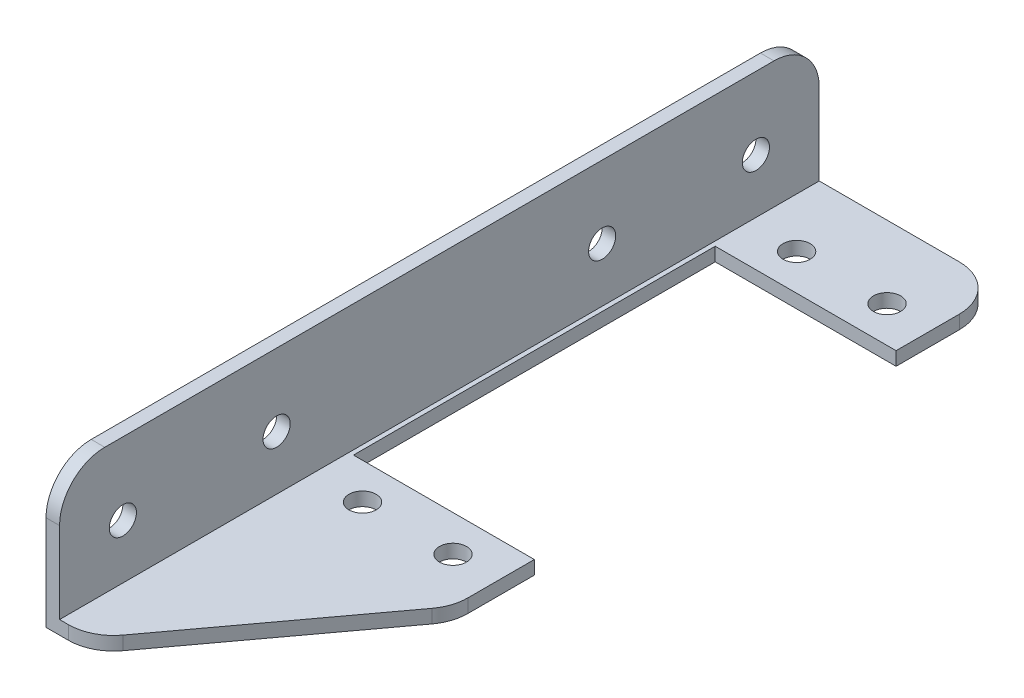
from build123d import *

# Parameters (mm, degrees)
EXTRU_MINCE1_DEPTH      = 84
ESQUISSE2_R             = 1.5
ENL_V_MAT_EXTRU_1_DEPTH = 8
ESQUISSE3_R             = 1.5
ESQUISSE3_W             = 25.5
ESQUISSE3_H             = 40
ENL_V_MAT_EXTRU_2_DEPTH = 5
ESQUISSE4_W             = 5.5
ESQUISSE4_H             = 84
ENL_V_MAT_EXTRU_3_DEPTH = 6
CHANFREIN1_SIZE         = 17
CHANFREIN1_SIZE2        = 23
CONG_1_R                = 5


with BuildPart() as part:
    # Esquisse1 → Extru.-Mince1 (new body)
    with BuildSketch(Plane.XY):
        Polygon((0, 15.5), (0, 0), (27.5, 0), (27.5, 1.5), (1.5, 1.5), (1.5, 15.5), align=None)
    extrude(amount=EXTRU_MINCE1_DEPTH)

    # Esquisse2 → Enlèv. mat.-Extru.1 (cut)
    with BuildSketch(Plane.ZY):
        with Locations(Location((7, 7.5, 0), (0, 0, 270))):
            Circle(ESQUISSE2_R)
        with Locations(Location((24, 7.5, 0), (0, 0, 270))):
            Circle(ESQUISSE2_R)
        with Locations(Location((60, 7.5, 0), (0, 0, 270))):
            Circle(ESQUISSE2_R)
        with Locations(Location((77, 7.5, 0), (0, 0, 90))):
            Circle(ESQUISSE2_R)
    extrude(amount=-ENL_V_MAT_EXTRU_1_DEPTH, mode=Mode.SUBTRACT)

    # Esquisse3 → Enlèv. mat.-Extru.2 (cut)
    with BuildSketch(Plane.XZ):
        with Locations(Location((7, 56, 0), (0, 0, 270))):
            Circle(ESQUISSE3_R)
        with Locations(Location((17, 56, 0), (0, 0, 270))):
            Circle(ESQUISSE3_R)
        with Locations(Location((17, 8, 0), (0, 0, 90))):
            Circle(ESQUISSE3_R)
        with Locations(Location((7, 8, 0), (0, 0, 90))):
            Circle(ESQUISSE3_R)
        with Locations((14.75, 32)):
            Rectangle(ESQUISSE3_W, ESQUISSE3_H)
    extrude(amount=-ENL_V_MAT_EXTRU_2_DEPTH, mode=Mode.SUBTRACT)

    # Esquisse4 → Enlèv. mat.-Extru.3 (cut)
    with BuildSketch(Plane.XZ):
        with Locations((24.75, 42)):
            Rectangle(ESQUISSE4_W, ESQUISSE4_H)
    extrude(amount=-ENL_V_MAT_EXTRU_3_DEPTH, mode=Mode.SUBTRACT)

    # Chanfrein1
    chanfrein1_edges = [part.edges().sort_by_distance(p)[0] for p in [
        (22, 0.75, 84),
    ]]
    chanfrein1_side = [part.faces().sort_by_distance(p)[0] for p in [
        (0.75, 15.230881067, 84),
    ]]
    chamfer(chanfrein1_edges, length=CHANFREIN1_SIZE, length2=CHANFREIN1_SIZE2, reference=chanfrein1_side[0])

    # Congé1
    cong_1_edges = [part.edges().sort_by_distance(p)[0] for p in [
        (22, 0.75, 61),
        (5, 0.75, 84),
        (0.75, 15.5, 84),
        (0.75, 15.5, 0),
        (22, 0.75, 0),
    ]]
    fillet(cong_1_edges, radius=CONG_1_R)


solid = part.part
